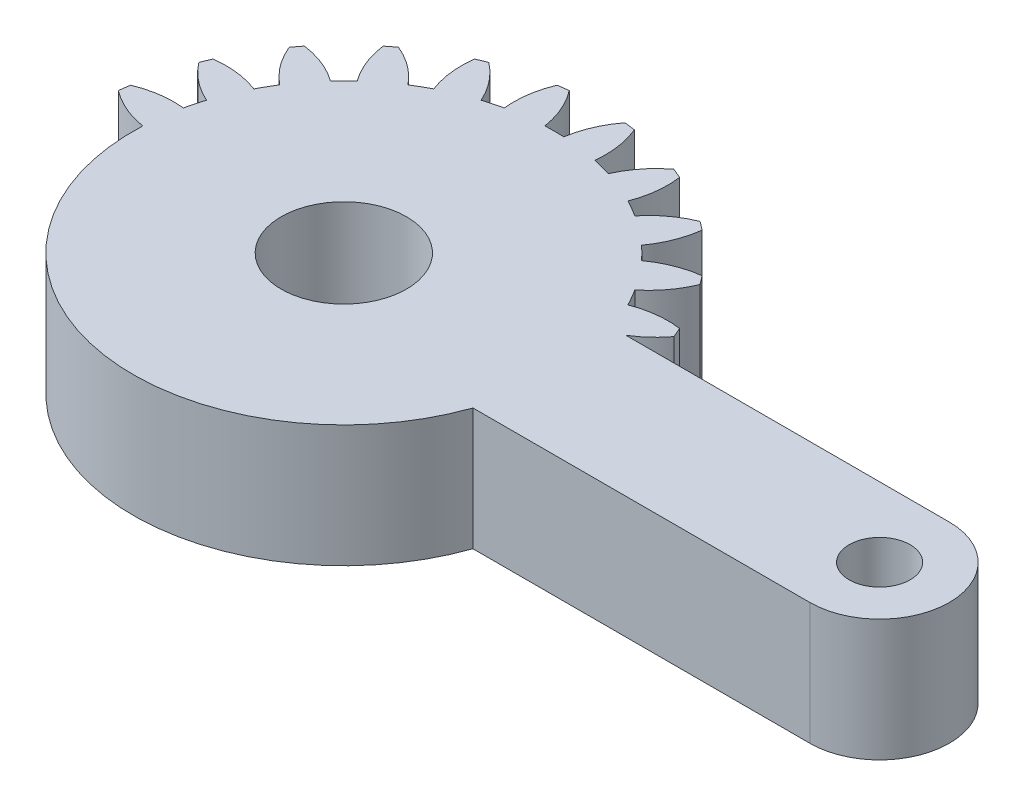
from build123d import *

# Parameters (mm, degrees)
SKETCH1_R           = 1.75
BOSS_EXTRUDE1_DEPTH = 7
SKETCH_1_R          = 3.6
CUT_EXTRUDE_1_DEPTH = 30.45578681


with BuildPart() as part:
    # Sketch1 → Boss-Extrude1 (new body)
    with BuildSketch(Plane(origin=(0, 4, 0), x_dir=(1, 0, 0), z_dir=(0, 1, 0))):
        with BuildLine():
            Line((1.305695063, -4), (20.643657446, -4))
            ThreePointArc((20.643657446, -4), (24.643657446, 0), (20.643657446, 4))
            Line((20.643657446, 4), (2.081641936, 4))
            ThreePointArc((2.081641936, 4), (2.861028333, 4.588201733), (3.521749436, 5.30713988))
            ThreePointArc((3.521749436, 5.30713988), (3.405395609, 5.596745198), (3.282888305, 5.883801663))
            ThreePointArc((3.282888305, 5.883801663), (1.93527598, 5.894040025), (0.627094961, 5.57027124))
            ThreePointArc((0.627094961, 5.57027124), (0.366286148, 6.046375), (0.084372603, 6.510293938))
            ThreePointArc((0.084372603, 6.510293938), (1.018855105, 7.48132754), (1.683794586, 8.65351323))
            ThreePointArc((1.683794586, 8.65351323), (1.496450048, 8.903135899), (1.303821399, 9.148703928))
            ThreePointArc((1.303821399, 9.148703928), (-0.000522033, 8.809805691), (-1.180330337, 8.158486898))
            ThreePointArc((-1.180330337, 8.158486898), (-1.555477026, 8.550865528), (-1.947855656, 8.926012217))
            ThreePointArc((-1.947855656, 8.926012217), (-1.296536862, 10.105820521), (-0.957638625, 11.410163953))
            ThreePointArc((-0.957638625, 11.410163953), (-1.203206655, 11.602792602), (-1.452829324, 11.79013714))
            ThreePointArc((-1.452829324, 11.79013714), (-2.625015014, 11.125197659), (-3.596048616, 10.190715157))
            ThreePointArc((-3.596048616, 10.190715157), (-4.059967554, 10.472628702), (-4.536071314, 10.733437515))
            ThreePointArc((-4.536071314, 10.733437515), (-4.212302529, 12.041618533), (-4.222540891, 13.389230859))
            ThreePointArc((-4.222540891, 13.389230859), (-4.509597355, 13.511738163), (-4.799202674, 13.62809199))
            ThreePointArc((-4.799202674, 13.62809199), (-5.759348103, 12.682425791), (-6.455432668, 11.528463019))
            ThreePointArc((-6.455432668, 11.528463019), (-6.976508546, 11.680699536), (-7.503891752, 11.809396783))
            ThreePointArc((-7.503891752, 11.809396783), (-7.529737283, 13.156800143), (-7.888414517, 14.455843809))
            ThreePointArc((-7.888414517, 14.455843809), (-8.197396993, 14.499881098), (-8.507248835, 14.537314892))
            ThreePointArc((-8.507248835, 14.537314892), (-9.18992168, 13.375367565), (-9.563620196, 12.080565177))
            ThreePointArc((-9.563620196, 12.080565177), (-10.106342554, 12.09275), (-10.649064912, 12.080565177))
            ThreePointArc((-10.649064912, 12.080565177), (-11.022763428, 13.375367565), (-11.705436272, 14.537314892))
            ThreePointArc((-11.705436272, 14.537314892), (-12.015288115, 14.499881098), (-12.324270591, 14.455843809))
            ThreePointArc((-12.324270591, 14.455843809), (-12.682947825, 13.156800143), (-12.708793355, 11.809396783))
            ThreePointArc((-12.708793355, 11.809396783), (-13.236176561, 11.680699536), (-13.757252439, 11.528463019))
            ThreePointArc((-13.757252439, 11.528463019), (-14.453337005, 12.682425791), (-15.413482434, 13.62809199))
            ThreePointArc((-15.413482434, 13.62809199), (-15.703087752, 13.511738163), (-15.990144217, 13.389230859))
            ThreePointArc((-15.990144217, 13.389230859), (-16.000382579, 12.041618533), (-15.676613793, 10.733437515))
            ThreePointArc((-15.676613793, 10.733437515), (-16.152717554, 10.472628702), (-16.616636492, 10.190715157))
            ThreePointArc((-16.616636492, 10.190715157), (-17.587670094, 11.125197659), (-18.759855783, 11.79013714))
            ThreePointArc((-18.759855783, 11.79013714), (-19.009478453, 11.602792602), (-19.255046482, 11.410163953))
            ThreePointArc((-19.255046482, 11.410163953), (-18.916148245, 10.105820521), (-18.264829452, 8.926012217))
            ThreePointArc((-18.264829452, 8.926012217), (-18.657208082, 8.550865528), (-19.032354771, 8.158486898))
            ThreePointArc((-19.032354771, 8.158486898), (-20.212163074, 8.809805691), (-21.516506507, 9.148703928))
            ThreePointArc((-21.516506507, 9.148703928), (-21.709135156, 8.903135899), (-21.896479694, 8.65351323))
            ThreePointArc((-21.896479694, 8.65351323), (-21.231540213, 7.48132754), (-20.297057711, 6.510293938))
            ThreePointArc((-20.297057711, 6.510293938), (-20.578971255, 6.046375), (-20.839780068, 5.57027124))
            ThreePointArc((-20.839780068, 5.57027124), (-22.147961087, 5.894040025), (-23.495573413, 5.883801663))
            ThreePointArc((-23.495573413, 5.883801663), (-23.618080717, 5.596745198), (-23.734434544, 5.30713988))
            ThreePointArc((-23.734434544, 5.30713988), (-22.788768345, 4.346994451), (-21.634805572, 3.650909885))
            ThreePointArc((-21.634805572, 3.650909885), (-21.78704209, 3.129834008), (-21.915739337, 2.602450802))
            ThreePointArc((-21.915739337, 2.602450802), (-23.263142697, 2.576605271), (-24.562186363, 2.217928037))
            ThreePointArc((-24.562186363, 2.217928037), (-24.606223651, 1.908945561), (-24.643657446, 1.599093719))
            ThreePointArc((-24.643657446, 1.599093719), (-23.481710119, 0.916420874), (-22.186907731, 0.542722358))
            ThreePointArc((-22.186907731, 0.542722358), (-12.402167869, -11.872817218), (1.305695063, -4))
        make_face()
        with Locations(Location((20.643657446, 0, 0), (0, 0, 90))):
            Circle(SKETCH1_R, mode=Mode.SUBTRACT)
    extrude(amount=-BOSS_EXTRUDE1_DEPTH)

    # 草图1 → 切除-拉伸1 (cut, through all)
    with BuildSketch(Plane.XZ.offset(3)):
        with Locations(Location((-10.106342554, 0, 0), (0, 0, 270))):
            Circle(SKETCH_1_R)
    extrude(amount=-CUT_EXTRUDE_1_DEPTH, mode=Mode.SUBTRACT)


solid = part.part
